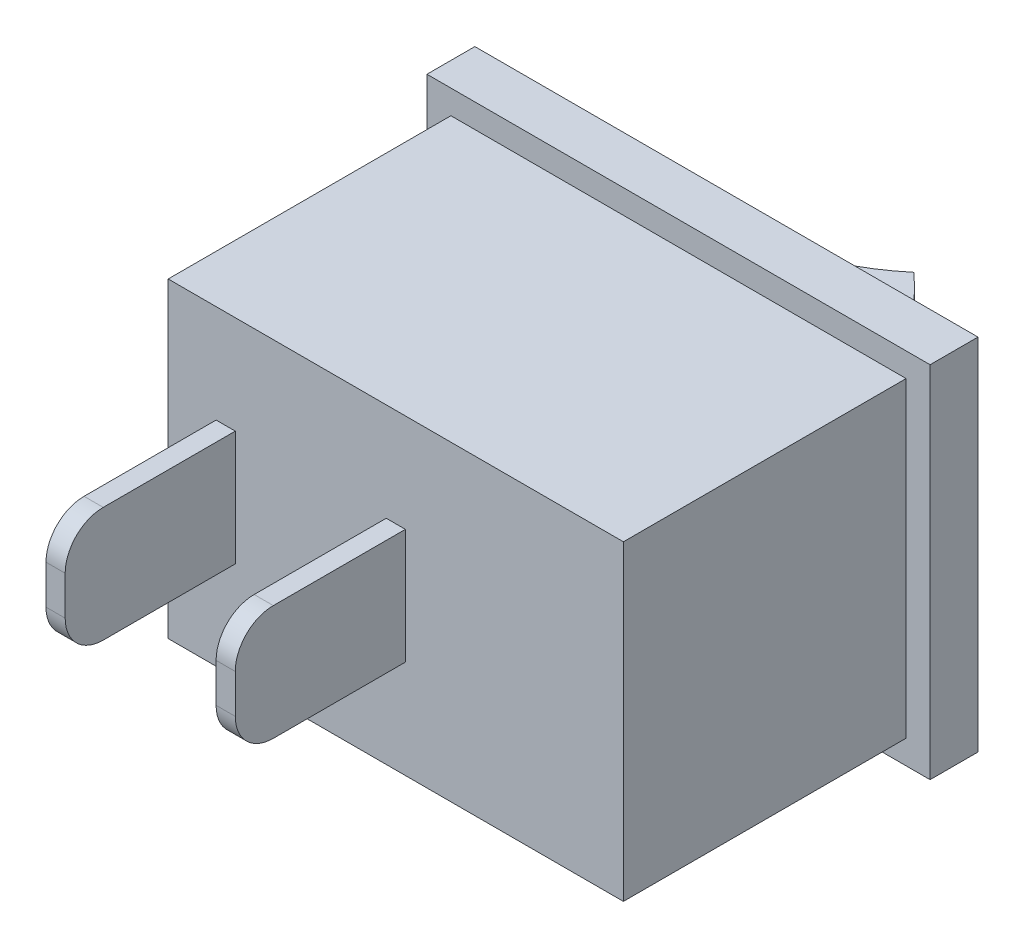
from build123d import *

# Parameters (mm, degrees)
SKETCH1_W           = 21
SKETCH1_H           = 15
BOSS_EXTRUDE1_DEPTH = 2
BOSS_EXTRUDE2_DEPTH = 5
SKETCH3_W           = 19
SKETCH3_H           = 13
BOSS_EXTRUDE3_DEPTH = 11.8
SKETCH4_W           = 0.8
SKETCH4_H           = 4.8
BOSS_EXTRUDE4_DEPTH = 7.1
FILLET1_R           = 1.5875


with BuildPart() as part:
    # Sketch1 → Boss-Extrude1 (new body)
    with BuildSketch(Plane.XY):
        with Locations((10.5, 7.5)):
            Rectangle(SKETCH1_W, SKETCH1_H)
    extrude(amount=BOSS_EXTRUDE1_DEPTH)

    # Sketch2 → Boss-Extrude2 (add, symmetric)
    with BuildSketch(Plane(origin=(0, 7.5, 0), x_dir=(-1, 0, 0), z_dir=(0, -1, 0))):
        with BuildLine():
            Line((-14.818, 0), (-17.358, 0))
            add(Edge.make_bspline(
                [(-17.358, 0), (-16.707682386, 1.839588495), (-14.818, 3.5)],
                knots=[0, 0, 0, 1, 1, 1], degree=2))
            add(Edge.make_bspline(
                [(-14.818, 3.5), (-12.312840272, 1.371089101), (-7.964569246, 0.392132644), (-3.642, 0)],
                knots=[0, 0, 0, 0, 1, 1, 1, 1], degree=3))
            Line((-3.642, 0), (-14.818, 0))
        make_face()
    extrude(amount=BOSS_EXTRUDE2_DEPTH, both=True)

    # Sketch3 → Boss-Extrude3 (add)
    with BuildSketch(Plane.XY.offset(2)):
        with Locations((10.5, 7.5)):
            Rectangle(SKETCH3_W, SKETCH3_H)
    extrude(amount=BOSS_EXTRUDE3_DEPTH)

    # Sketch4 → Boss-Extrude4 (add)
    with BuildSketch(Plane.XY.offset(13.8)):
        with Locations((3.4, 7.5)):
            Rectangle(SKETCH4_W, SKETCH4_H)
        with Locations((10.5, 7.5)):
            Rectangle(SKETCH4_W, SKETCH4_H)
    extrude(amount=BOSS_EXTRUDE4_DEPTH)

    # Fillet1
    fillet1_edges = [part.edges().sort_by_distance(p)[0] for p in [
        (3.4, 5.1, 20.9),
        (3.4, 9.9, 20.9),
        (10.5, 5.1, 20.9),
        (10.5, 9.9, 20.9),
    ]]
    fillet(fillet1_edges, radius=FILLET1_R)


solid = part.part
